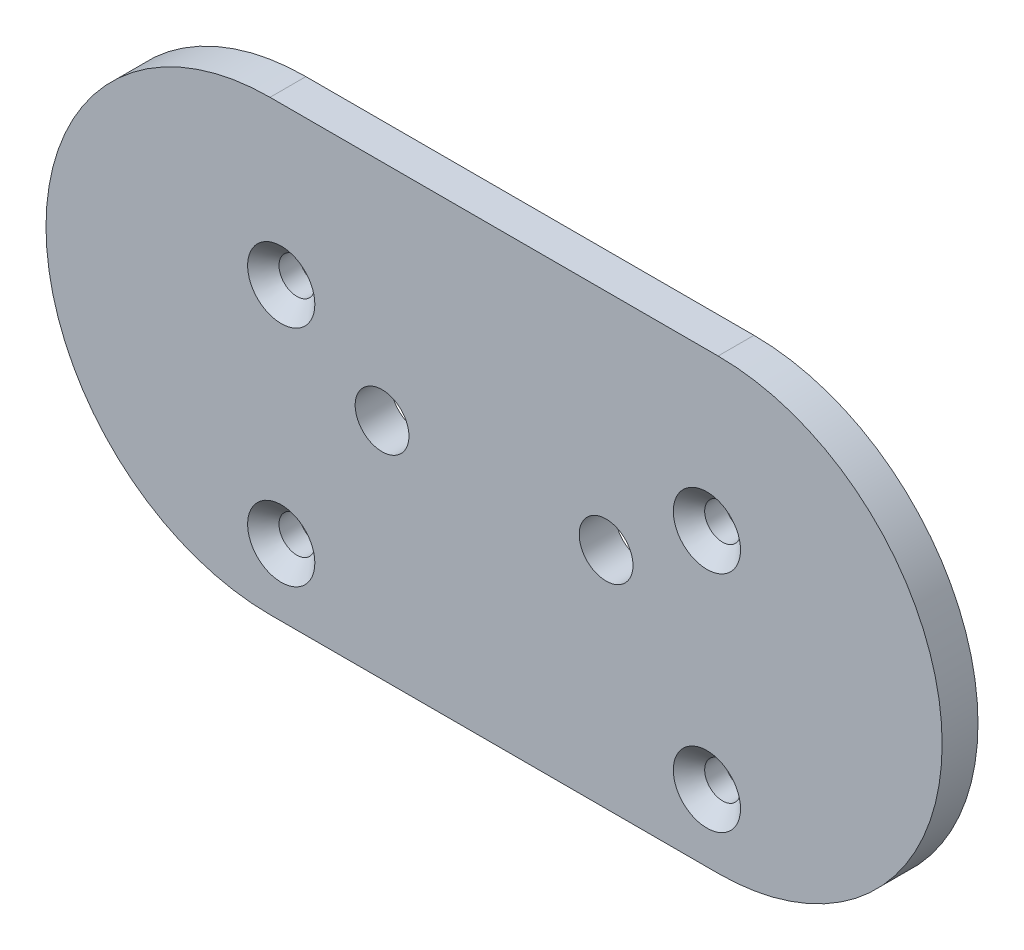
from build123d import *

# Parameters (mm, degrees)
SKETCH_1_R      = 1.6
SKETCH_1_R_2    = 2.4
EXTRUDE_1_DEPTH = 3.2
CHAMFER_1_SIZE  = 1.4


with BuildPart() as part:
    # 草图1 → 凸台-拉伸1 (new body)
    with BuildSketch(Plane.XY):
        with BuildLine():
            Line((-20, 20), (20, 20))
            ThreePointArc((20, 20), (40, 0), (20, -20))
            Line((20, -20), (-20, -20))
            ThreePointArc((-20, -20), (-40, 0), (-20, 20))
        make_face()
        with Locations((-19, -14)):
            Circle(SKETCH_1_R, mode=Mode.SUBTRACT)
        with Locations((19, -14)):
            Circle(SKETCH_1_R, mode=Mode.SUBTRACT)
        with Locations((19, 6)):
            Circle(SKETCH_1_R, mode=Mode.SUBTRACT)
        with Locations((-19, 6)):
            Circle(SKETCH_1_R, mode=Mode.SUBTRACT)
        with Locations((-10, 0)):
            Circle(SKETCH_1_R_2, mode=Mode.SUBTRACT)
        with Locations((10, 0)):
            Circle(SKETCH_1_R_2, mode=Mode.SUBTRACT)
    extrude(amount=EXTRUDE_1_DEPTH)

    # 倒角1
    chamfer_1_edges = [part.edges().sort_by_distance(p)[0] for p in [
        (-20.6, -14, 3.2),
        (17.4, -14, 3.2),
        (17.4, 6, 3.2),
        (-20.6, 6, 3.2),
    ]]
    chamfer(chamfer_1_edges, length=CHAMFER_1_SIZE)


solid = part.part
